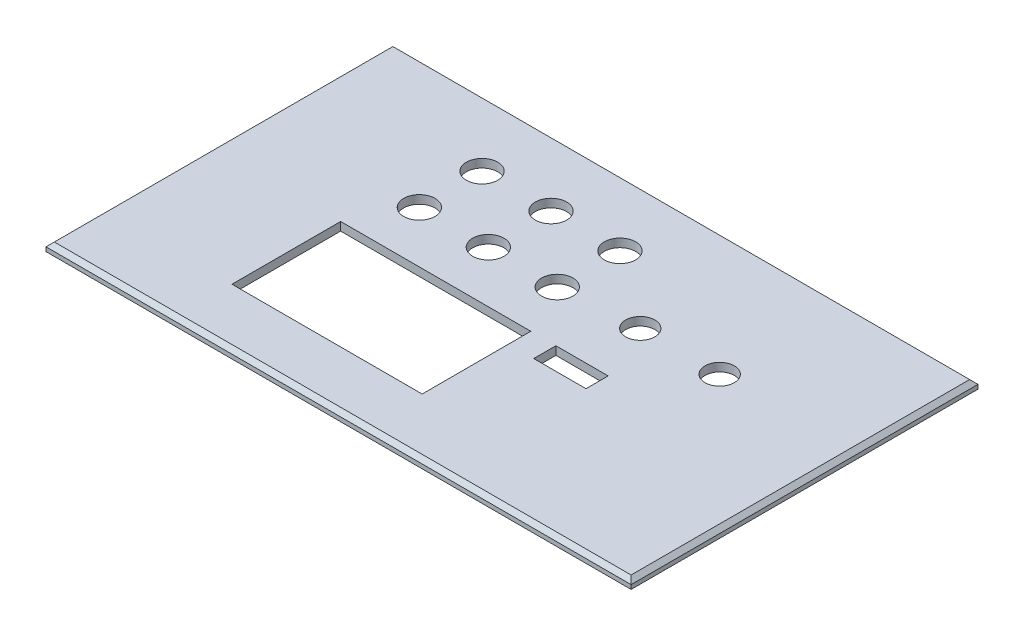
from build123d import *

# Parameters (mm, degrees)
SKETCH2_W           = 140
SKETCH2_H           = 83
SKETCH2_R           = 3.75
SKETCH2_R_2         = 3.5
SKETCH2_W_2         = 45.5
SKETCH2_H_2         = 26
SKETCH2_W_3         = 12.5
SKETCH2_H_3         = 5.3
BOSS_EXTRUDE1_DEPTH = 2
CHAMFER1_SIZE       = 1


with BuildPart() as part:
    # Sketch2 → Boss-Extrude1 (new body)
    with BuildSketch(Plane(origin=(0, 0, 0), x_dir=(1, 0, 0), z_dir=(0, 1, 0))):
        with Locations((-123.656387665, -10.354625551)):
            Rectangle(SKETCH2_W, SKETCH2_H)
        with Locations(Location((-156.156387665, 14.977524107, 0), (0, 0, 270))):
            Circle(SKETCH2_R, mode=Mode.SUBTRACT)
        with Locations(Location((-139.656387665, 14.977524107, 0), (0, 0, 270))):
            Circle(SKETCH2_R, mode=Mode.SUBTRACT)
        with Locations(Location((-123.156387665, 14.977524107, 0), (0, 0, 270))):
            Circle(SKETCH2_R, mode=Mode.SUBTRACT)
        with Locations(Location((-123.156387665, -0.022475893, 0), (0, 0, 270))):
            Circle(SKETCH2_R, mode=Mode.SUBTRACT)
        with Locations(Location((-139.656387665, -0.022475893, 0), (0, 0, 270))):
            Circle(SKETCH2_R, mode=Mode.SUBTRACT)
        with Locations(Location((-156.156387665, -0.022475893, 0), (0, 0, 270))):
            Circle(SKETCH2_R, mode=Mode.SUBTRACT)
        with Locations(Location((-85.656387665, 1.339603921, 0), (0, 0, 270))):
            Circle(SKETCH2_R_2, mode=Mode.SUBTRACT)
        with Locations(Location((-104.656387665, 1.339603921, 0), (0, 0, 270))):
            Circle(SKETCH2_R_2, mode=Mode.SUBTRACT)
        with Locations((-139.906387665, -25.354625551)):
            Rectangle(SKETCH2_W_2, SKETCH2_H_2, mode=Mode.SUBTRACT)
        with Locations((-104.906387665, -15.00079349)):
            Rectangle(SKETCH2_W_3, SKETCH2_H_3, mode=Mode.SUBTRACT)
    extrude(amount=BOSS_EXTRUDE1_DEPTH)

    # Chamfer1
    chamfer1_edges = [part.edges().sort_by_distance(p)[0] for p in [
        (-193.656387665, 2, 10.354625551),
        (-123.656387665, 2, 51.854625551),
        (-53.656387665, 2, 10.354625551),
        (-123.656387665, 2, -31.145374449),
    ]]
    chamfer(chamfer1_edges, length=CHAMFER1_SIZE)


solid = part.part
